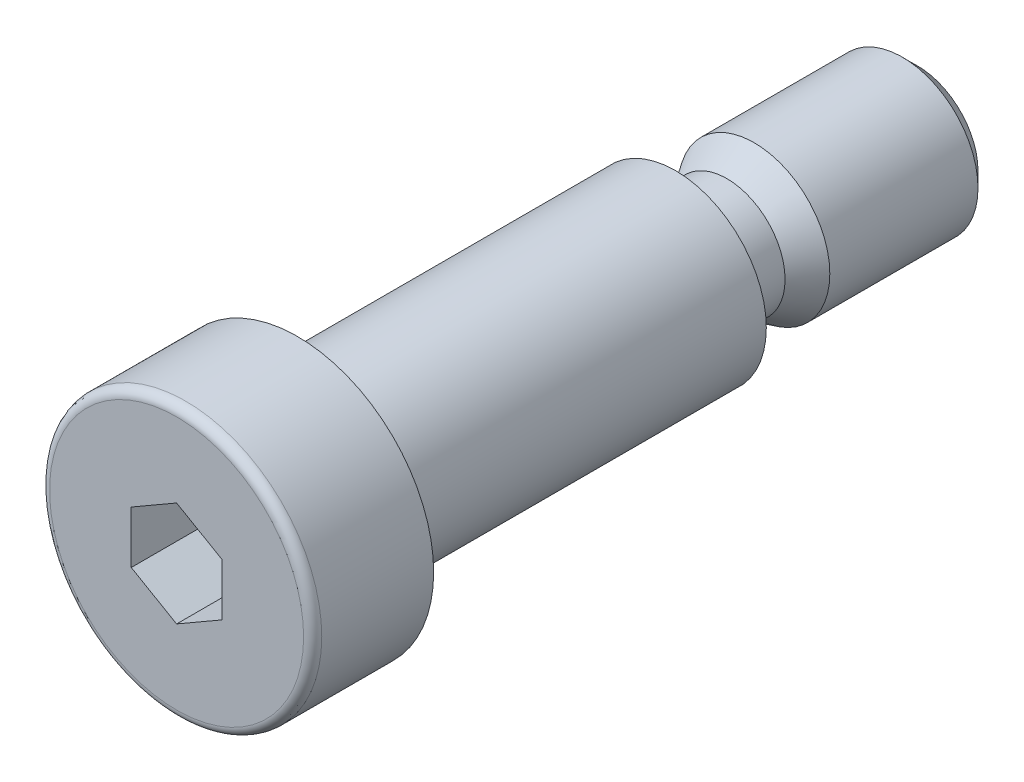
from build123d import *

# Parameters (mm, degrees)
SZKIC1_W                   = 3.85
SZKIC1_H                   = 3.39
WYTNIJ_WYCI_GNI_CIE1_DEPTH = 4.9
ZAOKR_GLENIE1_R            = 0.6


with BuildPart() as part:
    # Szkic1 → Obrót1 (revolve)
    with BuildSketch(Plane(origin=(0, 0, 0), x_dir=(1, 0, 0), z_dir=(0, 1, 0)), mode=Mode.PRIVATE) as obr_t1_sk:
        Polygon((0, -20.5), (0, -12.5), (-6, -12.5), (-9, -12.5), (-9, -20.5), align=None)
        Polygon((0, -12.5), (0, 12.5), (-3.85, 12.5), (-6, 12.5), (-6, -12.5), align=None)
        with Locations((-1.925, 14.195)):
            Rectangle(SZKIC1_W, SZKIC1_H)
        Polygon((-3.85, 15.89), (0, 15.89), (0, 28.5), (-4, 28.5), (-5, 27.5), (-5, 17.7), align=None)
    revolve(obr_t1_sk.sketch.rotate(Axis((0, 0, 20.5), (0, 0, -1)), 180), axis=Axis((0, 0, 20.5), (0, 0, -1)))

    # Szkic2 → Wytnij-wyciągnięcie1 (cut)
    with BuildSketch(Plane.XY.offset(20.5)):
        Polygon((3, 1.732050808), (0, 3.464101615), (-3, 1.732050808), (-3, -1.732050808), (0, -3.464101615), (3, -1.732050808), align=None)
    extrude(amount=-WYTNIJ_WYCI_GNI_CIE1_DEPTH, mode=Mode.SUBTRACT)

    # Zaokrąglenie1
    zaokr_glenie1_edges = [part.edges().sort_by_distance(p)[0] for p in [
        (-9, 0, 20.5),
    ]]
    fillet(zaokr_glenie1_edges, radius=ZAOKR_GLENIE1_R)


solid = part.part
